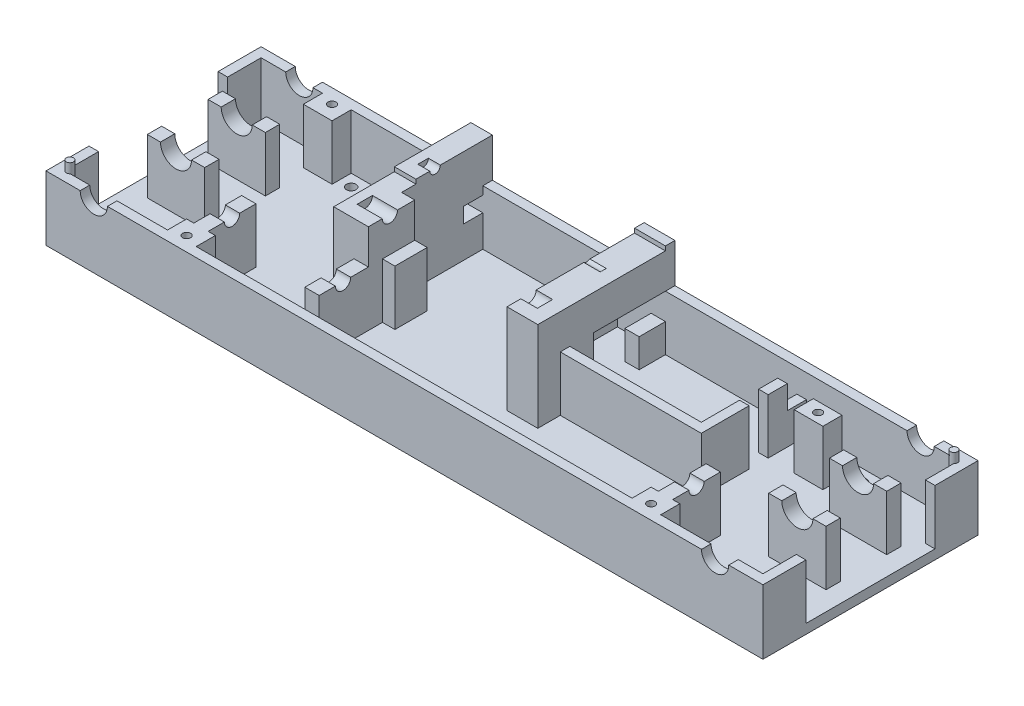
from build123d import *

# Parameters (mm, degrees)
SKETCH_1_W          = 150
SKETCH_1_H          = 45
EXTRUDE_1_DEPTH     = 2
SKETCH_2_W          = 12
SKETCH_2_H          = 3
EXTRUDE_2_DEPTH     = 11.5
SKETCH_4_W          = 3
SKETCH_4_H          = 10
SKETCH_4_W_2        = 2
SKETCH_4_H_2        = 8
EXTRUDE_3_DEPTH     = 11.5
CUT_EXTRUDE_1_REACH = 90.5
SKETCH_5_R          = 2.85
CUT_EXTRUDE_START   = -100.189473
SKETCH_6_R          = 1.6
CUT_EXTRUDE_2_DEPTH = 100.189473
SKETCH_7_W          = 6.45
SKETCH_7_H          = 28.7
EXTRUDE_6_DEPTH     = 7.3
SKETCH_8_W          = 4.5
SKETCH_8_H          = 16
SKETCH_8_W_2        = 6.45
SKETCH_8_H_2        = 2
EXTRUDE_7_DEPTH     = 0.9
CUT_EXTRUDE_START_2 = -3
SKETCH_9_R          = 1.1
SKETCH_9_R_2        = 1.6
CUT_EXTRUDE_3_DEPTH = 37.7
CUT_EXTRUDE_4_REACH = 84.686
SKETCH_10_W         = 4
SKETCH_10_H         = 3.2
CUT_EXTRUDE_8_REACH = 122.235
SKETCH_20_W         = 4
SKETCH_20_H         = 4.9
EXTRUDE_START       = -27
SKETCH_11_W         = 6
SKETCH_11_H         = 4
EXTRUDE_10_DEPTH    = 13.5
CUT_EXTRUDE_5_REACH = 83.254
SKETCH_13_R         = 0.825
CUT_EXTRUDE_START_3 = -32.9
SKETCH_14_R         = 3.25
CUT_EXTRUDE_6_DEPTH = 15.7
EXTRUDE_START_2     = -11.5
SKETCH_17_R         = 0.75
EXTRUDE_12_DEPTH    = 13.5
SKETCH_18_W         = 3
SKETCH_18_H         = 5.5
EXTRUDE_15_DEPTH    = 6
CUT_EXTRUDE_7_REACH = 82.742
SKETCH_19_R         = 1


with BuildPart() as part:
    # 草图1 → 凸台-拉伸1 (new body)
    with BuildSketch(Plane(origin=(0, 0, 0), x_dir=(1, 0, 0), z_dir=(0, 1, 0))):
        Rectangle(SKETCH_1_W, SKETCH_1_H)
    extrude(amount=EXTRUDE_1_DEPTH)

    # 草图2 → 凸台-拉伸2 (add)
    with BuildSketch(Plane(origin=(0, 2, 0), x_dir=(1, 0, 0), z_dir=(0, 1, 0))):
        Polygon((-75, 22.5), (75, 22.5), (75, 13.5), (73, 13.5), (73, 20.5), (1.55, 20.5), (1.55, 8.5), (-0.95, 8.5), (-0.95, 20.5), (-26.6, 20.5), (-26.6, 6.5), (-31.1, 6.5), (-31.1, 20.5), (-73, 20.5), (-73, 13.5), (-75, 13.5), align=None)
        Polygon((75, -22.5), (-75, -22.5), (-75, -13.5), (-73, -13.5), (-73, -20.5), (73, -20.5), (73, -13.5), (75, -13.5), align=None)
        with Locations((-65, -3.8)):
            Rectangle(SKETCH_2_W, SKETCH_2_H)
        with Locations((65, -3.8)):
            Rectangle(SKETCH_2_W, SKETCH_2_H)
        with Locations((-65, 8.9)):
            Rectangle(SKETCH_2_W, SKETCH_2_H)
        with Locations((65, 8.9)):
            Rectangle(SKETCH_2_W, SKETCH_2_H)
    extrude(amount=EXTRUDE_2_DEPTH)

    # 草图4 → 凸台-拉伸3 (add)
    with BuildSketch(Plane(origin=(0, 2, 0), x_dir=(1, 0, 0), z_dir=(0, 1, 0))):
        with Locations((-48.574736579, -11.5)):
            Rectangle(SKETCH_4_W, SKETCH_4_H)
        Polygon((-31.1, 6.5), (-26.6, 6.5), (-26.6, 3.5), (-23.85, 3.5), (-21.25, 3.5), (-21.25, -3.25), (-23.85, -3.25), (-23.85, -16.5), (-26.85, -16.5), (-26.85, -6.2), (-31.1, -6.2), align=None)
        with Locations((48.614736579, -11.5)):
            Rectangle(SKETCH_4_W, SKETCH_4_H)
        Polygon((5.15, 5.5), (11.6, 5.5), (11.6, 0.5), (39.1, 0.5), (39.1, 8.5), (41.1, 8.5), (41.1, -1.5), (11.6, -1.5), (11.6, -6.2), (5.15, -6.2), align=None)
        with Locations((40.1, 16.5)):
            Rectangle(SKETCH_4_W_2, SKETCH_4_H_2)
    extrude(amount=EXTRUDE_3_DEPTH)

    # 切除-拉伸1: up to this face of the body (flat: up to its plane)
    cut_extrude_1_end = Plane(part.part.faces().sort_by_distance((0, 6.75, -22.5))[0])
    # 草图5 → 切除-拉伸1 (cut, up to the picked face)
    with BuildSketch(Plane.XY.offset(22.5), mode=Mode.PRIVATE) as cut_extrude_1_sk1:
        with Locations((-65, 13.5)):
            Circle(SKETCH_5_R)
    cut_extrude_1_tool1 = split(extrude(cut_extrude_1_sk1.sketch, amount=-CUT_EXTRUDE_1_REACH, mode=Mode.PRIVATE), bisect_by=cut_extrude_1_end, keep=Keep.BOTH, mode=Mode.PRIVATE)
    # 草图5 → 切除-拉伸1 (cut, up to the picked face)
    with BuildSketch(Plane.XY.offset(22.5), mode=Mode.PRIVATE) as cut_extrude_1_sk2:
        with Locations((65, 13.5)):
            Circle(SKETCH_5_R)
    cut_extrude_1_tool2 = split(extrude(cut_extrude_1_sk2.sketch, amount=-CUT_EXTRUDE_1_REACH, mode=Mode.PRIVATE), bisect_by=cut_extrude_1_end, keep=Keep.BOTH, mode=Mode.PRIVATE)
    add(cut_extrude_1_tool1.solids().sort_by(Axis((-65, 13.5, 22.5), (0, 0, -1)))[0], mode=Mode.SUBTRACT)
    add(cut_extrude_1_tool2.solids().sort_by(Axis((65, 13.5, 22.5), (0, 0, -1)))[0], mode=Mode.SUBTRACT)

    # 草图6 → 切除-拉伸2 (cut)
    with BuildSketch(Plane(origin=(50.114736579, 0, 0), x_dir=(0, 0, -1), z_dir=(1, 0, 0)).offset(CUT_EXTRUDE_START)):
        with Locations((-11.5, 13.5)):
            Circle(SKETCH_6_R)
    extrude(amount=CUT_EXTRUDE_2_DEPTH, mode=Mode.SUBTRACT)

    # 草图7 → 凸台-拉伸6 (add)
    with BuildSketch(Plane(origin=(0, 13.5, 0), x_dir=(1, 0, 0), z_dir=(0, 1, 0))):
        with Locations((8.375, 8.15)):
            Rectangle(SKETCH_7_W, SKETCH_7_H)
        Polygon((-26.6, 22.5), (-26.6, 3.5), (-23.85, 3.5), (-23.85, -3.25), (-23.85, -6.2), (-31.1, -6.2), (-31.1, 22.5), align=None)
    extrude(amount=EXTRUDE_6_DEPTH)

    # 草图8 → 凸台-拉伸7 (add)
    with BuildSketch(Plane(origin=(0, 20.8, 0), x_dir=(1, 0, 0), z_dir=(0, 1, 0))):
        with Locations((-28.85, 14.5)):
            Rectangle(SKETCH_8_W, SKETCH_8_H)
        with Locations((8.375, 21.5)):
            Rectangle(SKETCH_8_W_2, SKETCH_8_H_2)
    extrude(amount=EXTRUDE_7_DEPTH)

    # 草图9 → 切除-拉伸3 (cut)
    with BuildSketch(Plane(origin=(11.6, 0, 0), x_dir=(0, 0, -1), z_dir=(1, 0, 0)).offset(CUT_EXTRUDE_START_2)):
        with Locations((10.5, 21.7)):
            Circle(SKETCH_9_R)
        with Locations((-1.7, 20.8)):
            Circle(SKETCH_9_R_2)
    extrude(amount=-CUT_EXTRUDE_3_DEPTH, mode=Mode.SUBTRACT)

    # 滑动杆切除-拉伸4: up to this face of the body (flat: up to its plane)
    cut_extrude_4_end = Plane(part.part.faces().sort_by_distance((-31.1, 11.825248606, -7.743924213))[0])
    # 草图10 → 滑动杆切除-拉伸4 (cut, up to the picked face)
    with BuildSketch(Plane(origin=(1.55, 0, 0), x_dir=(0, 0, -1), z_dir=(1, 0, 0)), mode=Mode.PRIVATE) as cut_extrude_4_sk1:
        with Locations((18.5, 10.2)):
            Rectangle(SKETCH_10_W, SKETCH_10_H)
    cut_extrude_4_tool1 = split(extrude(cut_extrude_4_sk1.sketch, amount=-CUT_EXTRUDE_4_REACH, mode=Mode.PRIVATE), bisect_by=cut_extrude_4_end, keep=Keep.BOTH, mode=Mode.PRIVATE)
    add(cut_extrude_4_tool1.solids().sort_by(Axis((1.55, 10.2, -18.5), (-1, 0, 0)))[0], mode=Mode.SUBTRACT)

    # 草图20 → 滑动杆安装切除-拉伸8 (cut, up to next)
    with BuildSketch(Plane(origin=(41.1, 0, 0), x_dir=(0, 0, -1), z_dir=(1, 0, 0)), mode=Mode.PRIVATE) as cut_extrude_8_sk1:
        with Locations((18.5, 11.05)):
            Rectangle(SKETCH_20_W, SKETCH_20_H)
    cut_extrude_8_tool1 = extrude(cut_extrude_8_sk1.sketch, amount=-CUT_EXTRUDE_8_REACH, mode=Mode.PRIVATE) & part.part
    add(cut_extrude_8_tool1.solids().sort_by_distance((41.1, 11.05, -18.5))[0], mode=Mode.SUBTRACT)

    # 草图11 → 螺丝孔凸台-拉伸10 (add)
    with BuildSketch(Plane(origin=(0, 27, 0), x_dir=(1, 0, 0), z_dir=(0, 1, 0)).offset(EXTRUDE_START)):
        with Locations((-48.574736579, -18.5)):
            Rectangle(SKETCH_11_W, SKETCH_11_H)
        with Locations((48.614736579, -18.5)):
            Rectangle(SKETCH_11_W, SKETCH_11_H)
        with Locations((49.55, 14.5)):
            Rectangle(SKETCH_11_W, SKETCH_11_H)
        with Locations((-57.15, 18.5)):
            Rectangle(SKETCH_11_W, SKETCH_11_H)
    extrude(amount=EXTRUDE_10_DEPTH)

    # 草图13 → 螺丝孔切除-拉伸5 (cut, up to next)
    with BuildSketch(Plane.XZ, mode=Mode.PRIVATE) as cut_extrude_5_sk1:
        with Locations(Location((-48.574736579, 19.5, 0), (0, 0, 270))):
            Circle(SKETCH_13_R)
    cut_extrude_5_tool1 = extrude(cut_extrude_5_sk1.sketch, amount=-CUT_EXTRUDE_5_REACH, mode=Mode.PRIVATE) & part.part
    # 草图13 → 螺丝孔切除-拉伸5 (cut, up to next)
    with BuildSketch(Plane.XZ, mode=Mode.PRIVATE) as cut_extrude_5_sk2:
        with Locations(Location((-57.15, -19.5, 0), (0, 0, 270))):
            Circle(SKETCH_13_R)
    cut_extrude_5_tool2 = extrude(cut_extrude_5_sk2.sketch, amount=-CUT_EXTRUDE_5_REACH, mode=Mode.PRIVATE) & part.part
    # 草图13 → 螺丝孔切除-拉伸5 (cut, up to next)
    with BuildSketch(Plane.XZ, mode=Mode.PRIVATE) as cut_extrude_5_sk3:
        with Locations(Location((48.614736579, 19.5, 0), (0, 0, 270))):
            Circle(SKETCH_13_R)
    cut_extrude_5_tool3 = extrude(cut_extrude_5_sk3.sketch, amount=-CUT_EXTRUDE_5_REACH, mode=Mode.PRIVATE) & part.part
    # 草图13 → 螺丝孔切除-拉伸5 (cut, up to next)
    with BuildSketch(Plane.XZ, mode=Mode.PRIVATE) as cut_extrude_5_sk4:
        with Locations(Location((49.55, -14.5, 0), (0, 0, 270))):
            Circle(SKETCH_13_R)
    cut_extrude_5_tool4 = extrude(cut_extrude_5_sk4.sketch, amount=-CUT_EXTRUDE_5_REACH, mode=Mode.PRIVATE) & part.part
    add(cut_extrude_5_tool1.solids().sort_by_distance((-48.574737, 0, 19.5))[0], mode=Mode.SUBTRACT)
    add(cut_extrude_5_tool2.solids().sort_by_distance((-57.15, 0, -19.5))[0], mode=Mode.SUBTRACT)
    add(cut_extrude_5_tool3.solids().sort_by_distance((48.614737, 0, 19.5))[0], mode=Mode.SUBTRACT)
    add(cut_extrude_5_tool4.solids().sort_by_distance((49.55, 0, -14.5))[0], mode=Mode.SUBTRACT)

    # 草图14 → 切除-拉伸6 (cut)
    with BuildSketch(Plane.XY.offset(22.5).offset(CUT_EXTRUDE_START_3)):
        with Locations((-65, 13.5)):
            Circle(SKETCH_14_R)
        with Locations((65, 13.5)):
            Circle(SKETCH_14_R)
    extrude(amount=CUT_EXTRUDE_6_DEPTH, mode=Mode.SUBTRACT)

    # 草图17 → 凸台-拉伸12 (add)
    with BuildSketch(Plane(origin=(0, 13.5, 0), x_dir=(1, 0, 0), z_dir=(0, 1, 0)).offset(EXTRUDE_START_2)):
        with Locations(Location((72.5, 20, 0), (0, 0, 138.189685104))):
            Circle(SKETCH_17_R)
        with Locations(Location((-72.5, -20, 0), (0, 0, 131.810314896))):
            Circle(SKETCH_17_R)
    extrude(amount=EXTRUDE_12_DEPTH)

    # 草图18 → 凸台-拉伸15 (add)
    with BuildSketch(Plane(origin=(0, 2, 0), x_dir=(1, 0, 0), z_dir=(0, 1, 0))):
        with Locations((10.1, 17.75)):
            Rectangle(SKETCH_18_W, SKETCH_18_H)
    extrude(amount=EXTRUDE_15_DEPTH)

    # 草图19 → 切除-拉伸7 (cut, up to next)
    with BuildSketch(Plane(origin=(0, 2, 0), x_dir=(1, 0, 0), z_dir=(0, 1, 0)), mode=Mode.PRIVATE) as cut_extrude_7_sk1:
        with Locations(Location((54.114736579, -18, 0), (0, 0, 270))):
            Circle(SKETCH_19_R)
    cut_extrude_7_tool1 = extrude(cut_extrude_7_sk1.sketch, amount=-CUT_EXTRUDE_7_REACH, mode=Mode.PRIVATE) & part.part
    # 草图19 → 切除-拉伸7 (cut, up to next)
    with BuildSketch(Plane(origin=(0, 2, 0), x_dir=(1, 0, 0), z_dir=(0, 1, 0)), mode=Mode.PRIVATE) as cut_extrude_7_sk2:
        with Locations(Location((-54.074736579, -18, 0), (0, 0, 270))):
            Circle(SKETCH_19_R)
    cut_extrude_7_tool2 = extrude(cut_extrude_7_sk2.sketch, amount=-CUT_EXTRUDE_7_REACH, mode=Mode.PRIVATE) & part.part
    # 草图19 → 切除-拉伸7 (cut, up to next)
    with BuildSketch(Plane(origin=(0, 2, 0), x_dir=(1, 0, 0), z_dir=(0, 1, 0)), mode=Mode.PRIVATE) as cut_extrude_7_sk3:
        with Locations(Location((-51.65, 18, 0), (0, 0, 270))):
            Circle(SKETCH_19_R)
    cut_extrude_7_tool3 = extrude(cut_extrude_7_sk3.sketch, amount=-CUT_EXTRUDE_7_REACH, mode=Mode.PRIVATE) & part.part
    # 草图19 → 切除-拉伸7 (cut, up to next)
    with BuildSketch(Plane(origin=(0, 2, 0), x_dir=(1, 0, 0), z_dir=(0, 1, 0)), mode=Mode.PRIVATE) as cut_extrude_7_sk4:
        with Locations(Location((55.25, 18, 0), (0, 0, 270))):
            Circle(SKETCH_19_R)
    cut_extrude_7_tool4 = extrude(cut_extrude_7_sk4.sketch, amount=-CUT_EXTRUDE_7_REACH, mode=Mode.PRIVATE) & part.part
    add(cut_extrude_7_tool1.solids().sort_by_distance((54.114737, 2, 18))[0], mode=Mode.SUBTRACT)
    add(cut_extrude_7_tool2.solids().sort_by_distance((-54.074737, 2, 18))[0], mode=Mode.SUBTRACT)
    add(cut_extrude_7_tool3.solids().sort_by_distance((-51.65, 2, -18))[0], mode=Mode.SUBTRACT)
    add(cut_extrude_7_tool4.solids().sort_by_distance((55.25, 2, -18))[0], mode=Mode.SUBTRACT)


solid = part.part
